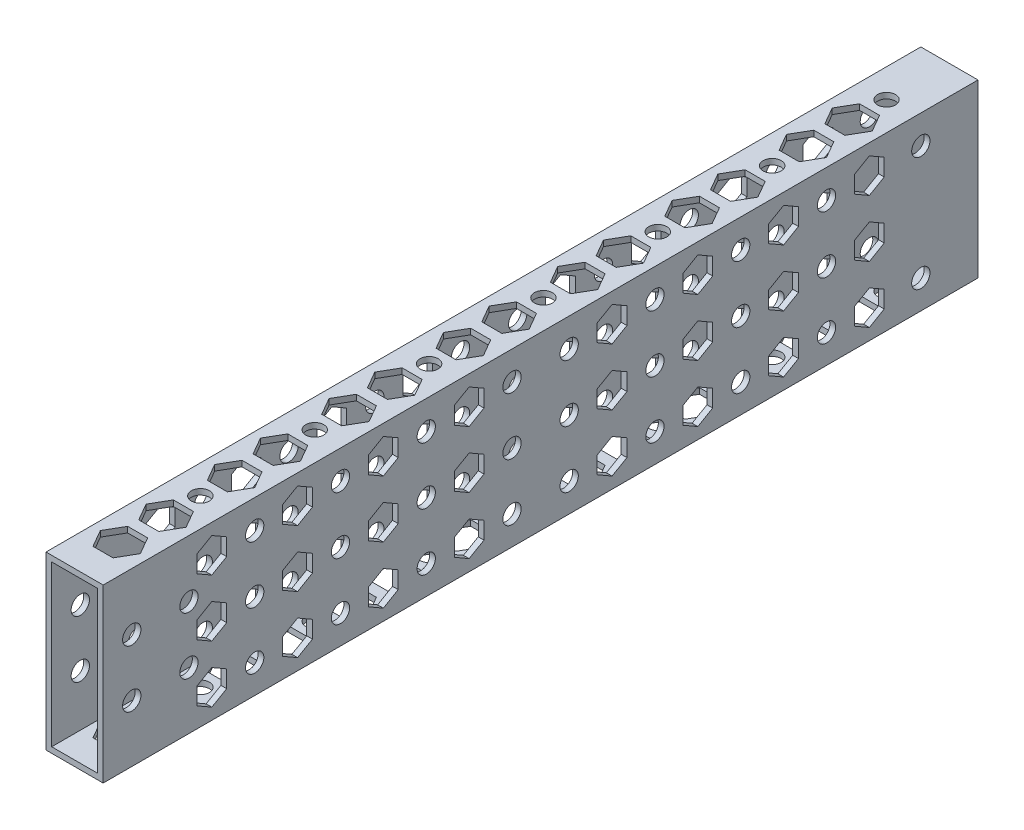
from build123d import *

# Parameters (mm, degrees)
SKETCH_1_W          = 10
SKETCH_1_H          = 30
SKETCH_1_W_2        = 8
SKETCH_1_H_2        = 28
EXTRUDE_1_DEPTH     = 153
SKETCH_2_R          = 1.575
CUT_EXTRUDE_1_DEPTH = 157.23379916
SKETCH_3_R          = 1.6
CUT_EXTRUDE_2_DEPTH = 157.23379916


with BuildPart() as part:
    # 草图1 → 拉伸-薄壁1 (new body)
    with BuildSketch(Plane.XY):
        with Locations((5, -15)):
            Rectangle(SKETCH_1_W, SKETCH_1_H)
        with Locations((5, -15)):
            Rectangle(SKETCH_1_W_2, SKETCH_1_H_2, mode=Mode.SUBTRACT)
    extrude(amount=EXTRUDE_1_DEPTH)

    # 草图2 → 切除-拉伸1 (cut, through all)
    with BuildSketch(Plane.XZ.offset(30)):
        with Locations(Location((5, 11, 0), (0, 0, 270))):
            Circle(SKETCH_2_R)
        with Locations(Location((5, 31, 0), (0, 0, 270))):
            Circle(SKETCH_2_R)
        with Locations(Location((5, 51, 0), (0, 0, 270))):
            Circle(SKETCH_2_R)
        with Locations(Location((5, 71, 0), (0, 0, 270))):
            Circle(SKETCH_2_R)
        with Locations(Location((5, 91, 0), (0, 0, 270))):
            Circle(SKETCH_2_R)
        with Locations(Location((5, 111, 0), (0, 0, 270))):
            Circle(SKETCH_2_R)
        with Locations(Location((5, 131, 0), (0, 0, 270))):
            Circle(SKETCH_2_R)
        Polygon((3.25, 20.031088913), (1.5, 17), (3.25, 13.968911087), (6.75, 13.968911087), (8.5, 17), (6.75, 20.031088913), align=None)
        Polygon((6.75, 21.968911087), (3.25, 21.968911087), (1.5, 25), (3.25, 28.031088913), (6.75, 28.031088913), (8.5, 25), align=None)
        Polygon((3.25, 33.968911087), (6.75, 33.968911087), (8.5, 37), (6.75, 40.031088913), (3.25, 40.031088913), (1.5, 37), align=None)
        Polygon((6.75, 41.968911087), (3.25, 41.968911087), (1.5, 45), (3.25, 48.031088913), (6.75, 48.031088913), (8.5, 45), align=None)
        Polygon((3.25, 53.968911087), (6.75, 53.968911087), (8.5, 57), (6.75, 60.031088913), (3.25, 60.031088913), (1.5, 57), align=None)
        Polygon((6.75, 61.968911087), (3.25, 61.968911087), (1.5, 65), (3.25, 68.031088913), (6.75, 68.031088913), (8.5, 65), align=None)
        Polygon((3.25, 73.968911087), (6.75, 73.968911087), (8.5, 77), (6.75, 80.031088913), (3.25, 80.031088913), (1.5, 77), align=None)
        Polygon((6.75, 81.968911087), (3.25, 81.968911087), (1.5, 85), (3.25, 88.031088913), (6.75, 88.031088913), (8.5, 85), align=None)
        Polygon((3.25, 93.968911087), (6.75, 93.968911087), (8.5, 97), (6.75, 100.031088913), (3.25, 100.031088913), (1.5, 97), align=None)
        Polygon((6.75, 101.968911087), (3.25, 101.968911087), (1.5, 105), (3.25, 108.031088913), (6.75, 108.031088913), (8.5, 105), align=None)
        Polygon((3.25, 113.968911087), (6.75, 113.968911087), (8.5, 117), (6.75, 120.031088913), (3.25, 120.031088913), (1.5, 117), align=None)
        Polygon((6.75, 121.968911087), (3.25, 121.968911087), (1.5, 125), (3.25, 128.031088913), (6.75, 128.031088913), (8.5, 125), align=None)
        Polygon((3.25, 133.968911087), (6.75, 133.968911087), (8.5, 137), (6.75, 140.031088913), (3.25, 140.031088913), (1.5, 137), align=None)
        Polygon((6.75, 141.968911087), (3.25, 141.968911087), (1.5, 145), (3.25, 148.031088913), (6.75, 148.031088913), (8.5, 145), align=None)
    extrude(amount=-CUT_EXTRUDE_1_DEPTH, mode=Mode.SUBTRACT)

    # 草图3 → 切除-拉伸2 (cut, through all)
    with BuildSketch(Plane.ZY):
        with Locations(Location((148, -10, 0), (0, 0, 270))):
            Circle(SKETCH_3_R)
        with Locations(Location((148, -20, 0), (0, 0, 270))):
            Circle(SKETCH_3_R)
        with Locations(Location((138, -20, 0), (0, 0, 270))):
            Circle(SKETCH_3_R)
        with Locations(Location((138, -10, 0), (0, 0, 270))):
            Circle(SKETCH_3_R)
        with Locations(Location((10, -5, 0), (0, 0, 270))):
            Circle(SKETCH_3_R)
        with Locations(Location((10, -25, 0), (0, 0, 270))):
            Circle(SKETCH_3_R)
        with Locations(Location((71.5, -5, 0), (0, 0, 270))):
            Circle(SKETCH_3_R)
        with Locations(Location((71.5, -15, 0), (0, 0, 270))):
            Circle(SKETCH_3_R)
        with Locations(Location((71.5, -25, 0), (0, 0, 270))):
            Circle(SKETCH_3_R)
        with Locations(Location((56.5, -5, 0), (0, 0, 270))):
            Circle(SKETCH_3_R)
        with Locations(Location((56.5, -15, 0), (0, 0, 270))):
            Circle(SKETCH_3_R)
        with Locations(Location((56.5, -25, 0), (0, 0, 270))):
            Circle(SKETCH_3_R)
        with Locations(Location((41.5, -5, 0), (0, 0, 270))):
            Circle(SKETCH_3_R)
        with Locations(Location((41.5, -15, 0), (0, 0, 270))):
            Circle(SKETCH_3_R)
        with Locations(Location((41.5, -25, 0), (0, 0, 270))):
            Circle(SKETCH_3_R)
        with Locations(Location((26.5, -5, 0), (0, 0, 270))):
            Circle(SKETCH_3_R)
        with Locations(Location((26.5, -15, 0), (0, 0, 270))):
            Circle(SKETCH_3_R)
        with Locations(Location((26.5, -25, 0), (0, 0, 270))):
            Circle(SKETCH_3_R)
        with Locations(Location((126.5, -25, 0), (0, 0, 270))):
            Circle(SKETCH_3_R)
        with Locations(Location((126.5, -15, 0), (0, 0, 270))):
            Circle(SKETCH_3_R)
        with Locations(Location((126.5, -5, 0), (0, 0, 270))):
            Circle(SKETCH_3_R)
        with Locations(Location((111.5, -25, 0), (0, 0, 270))):
            Circle(SKETCH_3_R)
        with Locations(Location((111.5, -15, 0), (0, 0, 270))):
            Circle(SKETCH_3_R)
        with Locations(Location((111.5, -5, 0), (0, 0, 270))):
            Circle(SKETCH_3_R)
        with Locations(Location((96.5, -25, 0), (0, 0, 270))):
            Circle(SKETCH_3_R)
        with Locations(Location((96.5, -15, 0), (0, 0, 270))):
            Circle(SKETCH_3_R)
        with Locations(Location((96.5, -5, 0), (0, 0, 270))):
            Circle(SKETCH_3_R)
        with Locations(Location((81.5, -25, 0), (0, 0, 270))):
            Circle(SKETCH_3_R)
        with Locations(Location((81.5, -15, 0), (0, 0, 270))):
            Circle(SKETCH_3_R)
        with Locations(Location((81.5, -5, 0), (0, 0, 270))):
            Circle(SKETCH_3_R)
        Polygon((64, -12), (61.401923789, -13.5), (61.401923789, -16.5), (64, -18), (66.598076211, -16.5), (66.598076211, -13.5), align=None)
        Polygon((64, -2), (61.401923789, -3.5), (61.401923789, -6.5), (64, -8), (66.598076211, -6.5), (66.598076211, -3.5), align=None)
        Polygon((64, -22), (61.401923789, -23.5), (61.401923789, -26.5), (64, -28), (66.598076211, -26.5), (66.598076211, -23.5), align=None)
        Polygon((49, -2), (46.401923789, -3.5), (46.401923789, -6.5), (49, -8), (51.598076211, -6.5), (51.598076211, -3.5), align=None)
        Polygon((49, -12), (46.401923789, -13.5), (46.401923789, -16.5), (49, -18), (51.598076211, -16.5), (51.598076211, -13.5), align=None)
        Polygon((51.598076211, -23.5), (49, -22), (46.401923789, -23.5), (46.401923789, -26.5), (49, -28), (51.598076211, -26.5), align=None)
        Polygon((34, -2), (31.401923789, -3.5), (31.401923789, -6.5), (34, -8), (36.598076211, -6.5), (36.598076211, -3.5), align=None)
        Polygon((34, -12), (31.401923789, -13.5), (31.401923789, -16.5), (34, -18), (36.598076211, -16.5), (36.598076211, -13.5), align=None)
        Polygon((36.598076211, -23.5), (34, -22), (31.401923789, -23.5), (31.401923789, -26.5), (34, -28), (36.598076211, -26.5), align=None)
        Polygon((19, -2), (16.401923789, -3.5), (16.401923789, -6.5), (19, -8), (21.598076211, -6.5), (21.598076211, -3.5), align=None)
        Polygon((19, -12), (16.401923789, -13.5), (16.401923789, -16.5), (19, -18), (21.598076211, -16.5), (21.598076211, -13.5), align=None)
        Polygon((21.598076211, -23.5), (19, -22), (16.401923789, -23.5), (16.401923789, -26.5), (19, -28), (21.598076211, -26.5), align=None)
        Polygon((136.598076211, -26.5), (134, -28), (131.401923789, -26.5), (131.401923789, -23.5), (134, -22), (136.598076211, -23.5), align=None)
        Polygon((136.598076211, -13.5), (136.598076211, -16.5), (134, -18), (131.401923789, -16.5), (131.401923789, -13.5), (134, -12), align=None)
        Polygon((136.598076211, -3.5), (136.598076211, -6.5), (134, -8), (131.401923789, -6.5), (131.401923789, -3.5), (134, -2), align=None)
        Polygon((121.598076211, -26.5), (119, -28), (116.401923789, -26.5), (116.401923789, -23.5), (119, -22), (121.598076211, -23.5), align=None)
        Polygon((121.598076211, -13.5), (121.598076211, -16.5), (119, -18), (116.401923789, -16.5), (116.401923789, -13.5), (119, -12), align=None)
        Polygon((121.598076211, -3.5), (121.598076211, -6.5), (119, -8), (116.401923789, -6.5), (116.401923789, -3.5), (119, -2), align=None)
        Polygon((106.598076211, -26.5), (104, -28), (101.401923789, -26.5), (101.401923789, -23.5), (104, -22), (106.598076211, -23.5), align=None)
        Polygon((106.598076211, -13.5), (106.598076211, -16.5), (104, -18), (101.401923789, -16.5), (101.401923789, -13.5), (104, -12), align=None)
        Polygon((106.598076211, -3.5), (106.598076211, -6.5), (104, -8), (101.401923789, -6.5), (101.401923789, -3.5), (104, -2), align=None)
        Polygon((91.598076211, -23.5), (91.598076211, -26.5), (89, -28), (86.401923789, -26.5), (86.401923789, -23.5), (89, -22), align=None)
        Polygon((91.598076211, -13.5), (91.598076211, -16.5), (89, -18), (86.401923789, -16.5), (86.401923789, -13.5), (89, -12), align=None)
        Polygon((86.401923789, -3.5), (89, -2), (91.598076211, -3.5), (91.598076211, -6.5), (89, -8), (86.401923789, -6.5), align=None)
    extrude(amount=-CUT_EXTRUDE_2_DEPTH, mode=Mode.SUBTRACT)


solid = part.part
